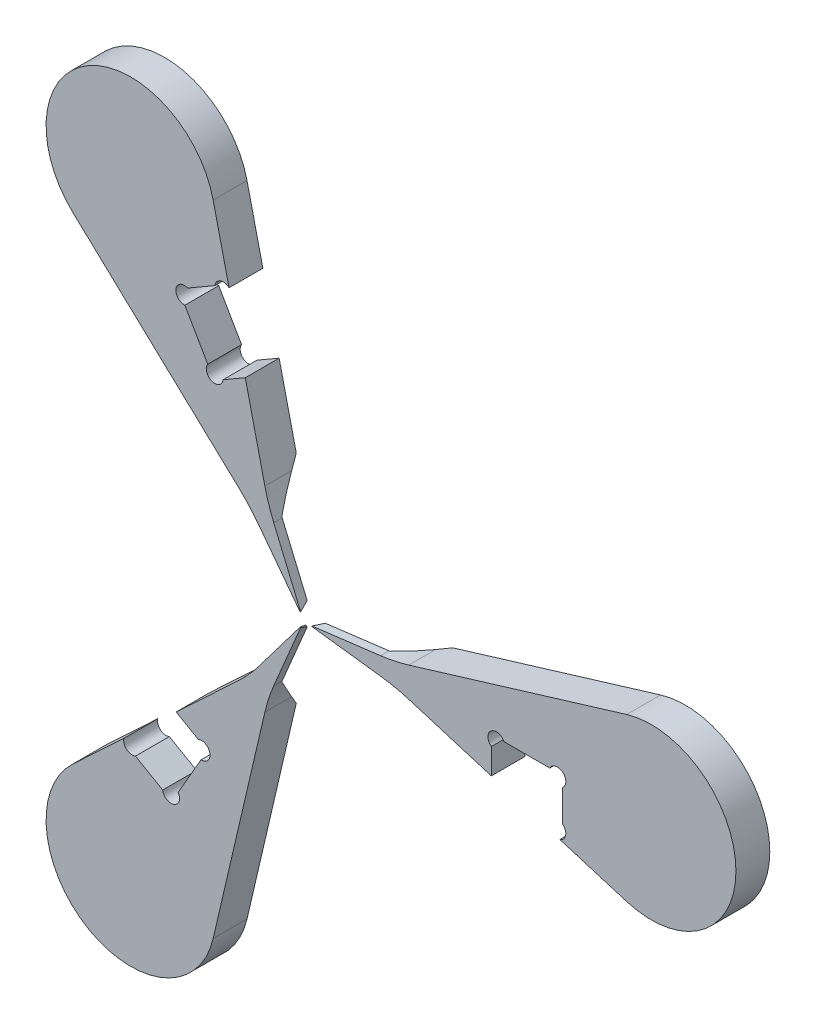
from build123d import *

# Parameters (mm, degrees)
EXTRUDE_1_DEPTH     = 2
EXTRUDE_1_2_DEPTH   = 2
EXTRUDE_1_3_DEPTH   = 2
CUT_EXTRUDE_1_DEPTH = 35.234086928


with BuildPart() as part:
    # 草圖1 → 填料-伸長1 (new body)
    with BuildSketch(Plane.XY):
        with BuildLine():
            Line((0.357380647, 0.004961492), (4.50941379, 0.523267787))
            ThreePointArc((4.50941379, 0.523267787), (5.349803134, 0.664770922), (6.175092484, 0.877314741))
            Line((6.175092484, 0.877314741), (19.047808057, 4.784468472))
            ThreePointArc((19.047808057, 4.784468472), (25.5, 0), (19.047808057, -4.784468472))
            Line((19.047808057, -4.784468472), (6.175092484, -0.877314741))
            ThreePointArc((6.175092484, -0.877314741), (5.349803134, -0.664770922), (4.50941379, -0.523267787))
            Line((4.50941379, -0.523267787), (0.357380647, -0.004961492))
            ThreePointArc((0.357380647, -0.004961492), (0.353, 0), (0.357380647, 0.004961492))
        make_face()
    extrude(amount=EXTRUDE_1_DEPTH)


with BuildPart() as body_2:
    # 草圖1 → Extrude 1 2 (new body)
    with BuildSketch(Plane.XY):
        with BuildLine():
            Line((-2.327769389, -5.786444332), (-5.380432788, -18.8881199))
            ThreePointArc((-5.380432788, -18.8881199), (-12.75, -22.083647797), (-13.667375269, -14.103651428))
            Line((-13.667375269, -14.103651428), (-3.847323094, -4.909129591))
            ThreePointArc((-3.847323094, -4.909129591), (-3.250610073, -4.300679958), (-2.707870091, -3.643633005))
            Line((-2.707870091, -3.643633005), (-0.182987102, -0.307019973))
            ThreePointArc((-0.182987102, -0.307019973), (-0.1765, -0.305706968), (-0.174393546, -0.311981465))
            Line((-0.174393546, -0.311981465), (-1.801543699, -4.166900792))
            ThreePointArc((-1.801543699, -4.166900792), (-2.09919306, -4.96545088), (-2.327769389, -5.786444332))
        make_face()
    extrude(amount=EXTRUDE_1_2_DEPTH)


with BuildPart() as body_3:
    # 草圖1 → Extrude 1 3 (new body)
    with BuildSketch(Plane.XY):
        with BuildLine():
            Line((-3.847323094, 4.909129591), (-13.667375269, 14.103651428))
            ThreePointArc((-13.667375269, 14.103651428), (-12.75, 22.083647797), (-5.380432788, 18.8881199))
            Line((-5.380432788, 18.8881199), (-2.327769389, 5.786444332))
            ThreePointArc((-2.327769389, 5.786444332), (-2.09919306, 4.96545088), (-1.801543699, 4.166900792))
            Line((-1.801543699, 4.166900792), (-0.174393546, 0.311981465))
            ThreePointArc((-0.174393546, 0.311981465), (-0.1765, 0.305706968), (-0.182987102, 0.307019973))
            Line((-0.182987102, 0.307019973), (-2.707870091, 3.643633005))
            ThreePointArc((-2.707870091, 3.643633005), (-3.250610073, 4.300679958), (-3.847323094, 4.909129591))
        make_face()
    extrude(amount=EXTRUDE_1_3_DEPTH)


with BuildPart() as cut_extrude_1_tool:
    # 草圖2 → 除料-伸長1 (new, through all)
    with BuildSketch(Plane.XY.offset(2)):
        with BuildLine():
            ThreePointArc((11.798296094, -0.228571429), (11.03056096, -0.065346), (11.05, -0.85))
            Line((11.05, -0.85), (11.05, -2.356956933))
            Line((11.05, -2.356956933), (15.09656548, -3.585179007))
            ThreePointArc((15.09656548, -3.585179007), (15.442536346, -3.193212295), (15.25, -2.707142857))
            Line((15.25, -2.707142857), (15.25, -0.85))
            ThreePointArc((15.25, -0.85), (15.26943904, -0.065346), (14.501703906, -0.228571429))
            Line((14.501703906, -0.228571429), (11.798296094, -0.228571429))
        make_face()
        with BuildLine():
            ThreePointArc((-6.888878407, 13.631887408), (-7.578128224, 13.25639511), (-7.052903289, 12.673129695))
            Line((-7.052903289, 12.673129695), (-5.701199383, 10.331909853))
            ThreePointArc((-5.701199383, 10.331909853), (-5.458689184, 9.585419009), (-4.788878407, 9.994580712))
            Line((-4.788878407, 9.994580712), (-3.48381542, 10.748059178))
            Line((-3.48381542, 10.748059178), (-4.443426643, 14.866598719))
            ThreePointArc((-4.443426643, 14.866598719), (-4.955865206, 14.970234922), (-5.280545514, 14.560458836))
            Line((-5.280545514, 14.560458836), (-6.888878407, 13.631887408))
        make_face()
        with BuildLine():
            ThreePointArc((-6.097096711, -10.103338424), (-5.571871776, -9.520073009), (-6.261121593, -9.144580712))
            Line((-6.261121593, -9.144580712), (-7.56618458, -8.391102245))
            Line((-7.56618458, -8.391102245), (-10.653138837, -11.281419712))
            ThreePointArc((-10.653138837, -11.281419712), (-10.48667114, -11.777022627), (-9.969454486, -11.853315979))
            Line((-9.969454486, -11.853315979), (-8.361121593, -12.781887408))
            ThreePointArc((-8.361121593, -12.781887408), (-7.691310816, -13.19104911), (-7.448800617, -12.444558267))
            Line((-7.448800617, -12.444558267), (-6.097096711, -10.103338424))
        make_face()
    extrude(amount=-CUT_EXTRUDE_1_DEPTH)


with BuildPart() as part_1:
    add(part.part)

    # 除料-伸長1: cut by cut_extrude_1_tool
    add(cut_extrude_1_tool.part, mode=Mode.SUBTRACT)


with BuildPart() as body_2_1:
    add(body_2.part)

    # 除料-伸長1: cut by cut_extrude_1_tool
    add(cut_extrude_1_tool.part, mode=Mode.SUBTRACT)


with BuildPart() as body_3_1:
    add(body_3.part)

    # 除料-伸長1: cut by cut_extrude_1_tool
    add(cut_extrude_1_tool.part, mode=Mode.SUBTRACT)


with BuildPart() as cut_revolve_2_tool:
    # 草圖3 → 除料-旋轉2 (revolve)
    with BuildSketch(Plane(origin=(0, 0, 0), x_dir=(1, 0, 0), z_dir=(0, 1, 0))):
        Polygon((0, -1.5), (4.6, -1.5), (6.86, 0), (0, 0), align=None)
    revolve(axis=Axis((0, 0, -1.706722595), (0, 0, 1)))


with BuildPart() as part_2:
    add(part_1.part)

    # 除料-旋轉2: cut by cut_revolve_2_tool
    add(cut_revolve_2_tool.part, mode=Mode.SUBTRACT)


with BuildPart() as body_2_2:
    add(body_2_1.part)

    # 除料-旋轉2: cut by cut_revolve_2_tool
    add(cut_revolve_2_tool.part, mode=Mode.SUBTRACT)


with BuildPart() as body_3_2:
    add(body_3_1.part)

    # 除料-旋轉2: cut by cut_revolve_2_tool
    add(cut_revolve_2_tool.part, mode=Mode.SUBTRACT)


with BuildPart() as cut_revolve_4_tool:
    # 草圖4 → 除料-旋轉4 (revolve)
    with BuildSketch(Plane(origin=(0, 0, 0), x_dir=(1, 0, 0), z_dir=(0, 1, 0))):
        Polygon((0.353, -2.18), (0.745598183, -1.5), (0.353, -1.5), align=None)
    revolve(axis=Axis((0, 0, -0.874986171), (0, 0, 1)))


with BuildPart() as part_3:
    add(part_2.part)

    # 除料-旋轉4: cut by cut_revolve_4_tool
    add(cut_revolve_4_tool.part, mode=Mode.SUBTRACT)


with BuildPart() as body_2_3:
    add(body_2_2.part)

    # 除料-旋轉4: cut by cut_revolve_4_tool
    add(cut_revolve_4_tool.part, mode=Mode.SUBTRACT)


with BuildPart() as body_3_3:
    add(body_3_2.part)

    # 除料-旋轉4: cut by cut_revolve_4_tool
    add(cut_revolve_4_tool.part, mode=Mode.SUBTRACT)


solid = Compound([part_3.part, body_2_3.part, body_3_3.part])
